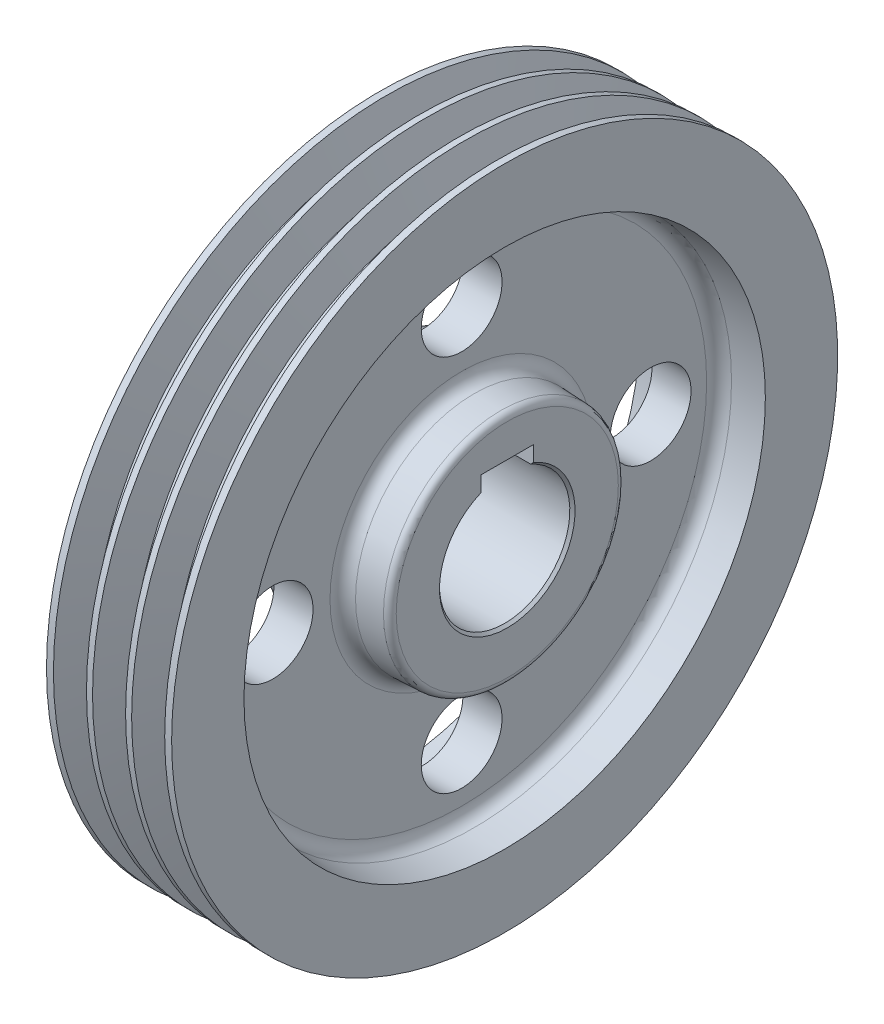
from build123d import *

# Parameters (mm, degrees)
PATTERN_LINEAR_1019_COUNT   = 3
PATTERN_LINEAR_1019_PITCH   = 15
CHAMFER_1_SIZE              = 1
SKETCH_4_W                  = 20
SKETCH_4_H                  = 6.987121525
CUT_EXTRUDE_1_DEPTH         = 188.456995068
FILLET_1_R                  = 5
FILLET_2_R                  = 2.5
SKETCH_5_R                  = 15.5
CUT_EXTRUDE_2_DEPTH         = 188.192748257
PATTERN_CIRCULAR_1950_COUNT = 4


with BuildPart() as part:
    # 草图1 → 旋转1 (revolve)
    with BuildSketch(Plane.XY, mode=Mode.PRIVATE) as revolve_1_sk:
        Polygon((-1, 25), (-1, 45), (16.5, 46.531051612), (16.5, 99.340175961), (0, 100), (0, 127.75), (48, 127.75), (48, 100), (31.5, 98.556437052), (31.5, 45.699813375), (49, 45), (49, 25), align=None)
    revolve(revolve_1_sk.sketch.rotate(Axis((0, 0, 0), (1, 0, 0)), 90), axis=Axis((0, 0, 0), (1, 0, 0)))

    # 草图2 → 切除-旋转1 (revolve, cut)
    with BuildSketch(Plane.XY, mode=Mode.PRIVATE) as cut_revolve_1_sk:
        Polygon((11.840143071, 116.3), (15.340759374, 127.75), (2.659240626, 127.75), (6.159856929, 116.3), align=None)
    cut_revolve_1 = revolve(cut_revolve_1_sk.sketch.rotate(Axis((0, 0, 0), (1, 0, 0)), 90), axis=Axis((0, 0, 0), (1, 0, 0)), mode=Mode.SUBTRACT)

    # Pattern Linear 1019: 切除-旋转1 ×3
    with Locations(*[(i * PATTERN_LINEAR_1019_PITCH, 0, 0) for i in range(1, PATTERN_LINEAR_1019_COUNT)]):
        add(cut_revolve_1, mode=Mode.SUBTRACT)

    # 倒角1
    chamfer_1_edges = [part.edges().sort_by_distance(p)[0] for p in [
        (-1, 0, -25),
        (49, 0, -25),
    ]]
    chamfer(chamfer_1_edges, length=CHAMFER_1_SIZE)

    # 草图4 → 切除-拉伸1 (cut, through all)
    with BuildSketch(Plane.ZY.offset(1)):
        with Locations((0, 26.406439238)):
            Rectangle(SKETCH_4_W, SKETCH_4_H)
    extrude(amount=-CUT_EXTRUDE_1_DEPTH, mode=Mode.SUBTRACT)

    # 圆角1
    fillet_1_edges = [part.edges().sort_by_distance(p)[0] for p in [
        (16.5, 0, -99.340175961),
        (16.5, 0, -46.531051612),
        (31.5, 0, -45.699813375),
        (31.5, 0, -98.556437052),
    ]]
    fillet(fillet_1_edges, radius=FILLET_1_R)

    # 圆角2
    fillet_2_edges = [part.edges().sort_by_distance(p)[0] for p in [
        (-1, 0, -45),
        (49, 0, -45),
    ]]
    fillet(fillet_2_edges, radius=FILLET_2_R)

    # 草图5 → 切除-拉伸2 (cut, through all)
    with BuildSketch(Plane(origin=(0, 0, 0), x_dir=(0, 0, -1), z_dir=(1, 0, 0))):
        with Locations(Location((0, 72.5, 0), (0, 0, 180))):
            Circle(SKETCH_5_R)
    cut_extrude_2 = extrude(amount=CUT_EXTRUDE_2_DEPTH, mode=Mode.SUBTRACT)

    # Pattern Circular 1950: 切除-拉伸2 ×4 about axis
    pattern_circular_1950_axis = Axis((0, 0, 0), (1, 0, 0))
    for i in range(1, PATTERN_CIRCULAR_1950_COUNT):
        add(cut_extrude_2.rotate(pattern_circular_1950_axis, i * 360 / PATTERN_CIRCULAR_1950_COUNT), mode=Mode.SUBTRACT)


solid = part.part
